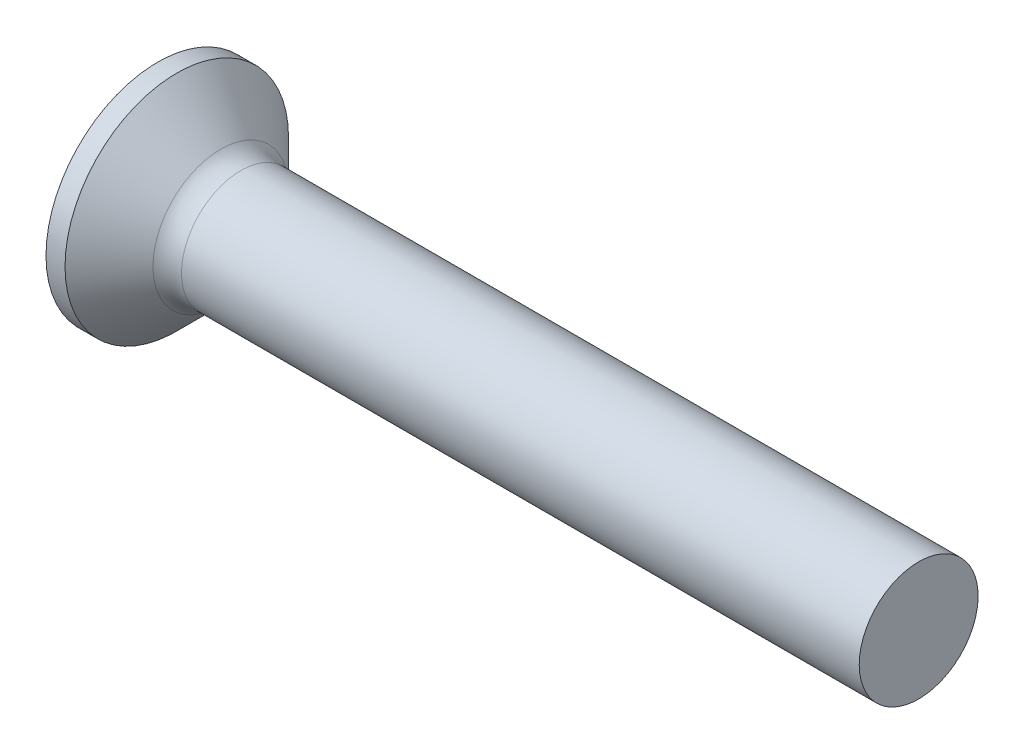
from build123d import *

# Parameters (mm, degrees)
FILLET1_R    = 0.6
RECPAT_COUNT = 2
RECPAT_ANGLE = 90


with BuildPart() as part:
    # BodySke → Base-Revolve (revolve)
    with BuildSketch(Plane.XY, mode=Mode.PRIVATE) as base_revolve_sk:
        Polygon((0, 0), (0, 2.35), (0.4, 2.35), (1.5, 1.25), (16, 1.25), (16, 0), align=None)
    revolve(base_revolve_sk.sketch.rotate(Axis((-6.35, 0, 0), (1, 0, 0)), 90), axis=Axis((-6.35, 0, 0), (1, 0, 0)))

    # Fillet1
    fillet1_edges = [part.edges().sort_by_distance(p)[0] for p in [
        (1.5, 0, -1.25),
    ]]
    fillet(fillet1_edges, radius=FILLET1_R)

    # Sketch3 → Recess section 0
    with BuildSketch(Plane.ZY):
        with BuildLine():
            Line((-0.37, 1.4), (0.37, 1.4))
            Line((0.37, 1.4), (0.37, -1.4))
            Line((0.37, -1.4), (-0.37, -1.4))
            Line((-0.37, -1.4), (-0.37, 1.4))
        make_face()
    # Sketch4 → Recess section 1
    with BuildSketch(Plane.ZY.offset(-1.73)):
        with BuildLine():
            Line((-0.37, 0.537453962), (0.37, 0.537453962))
            Line((0.37, 0.537453962), (0.37, -0.537453962))
            Line((0.37, -0.537453962), (-0.37, -0.537453962))
            Line((-0.37, -0.537453962), (-0.37, 0.537453962))
        make_face()
    recess = loft(mode=Mode.SUBTRACT)

    # RecPat: Recess ×2 about axis
    recpat_axis = Axis((0, 0, 0), (1, 0, 0))
    for i in range(1, RECPAT_COUNT):
        add(recess.rotate(recpat_axis, i * RECPAT_ANGLE / (RECPAT_COUNT - 1)), mode=Mode.SUBTRACT)

    # RecCorSke → RecessCore (revolve, cut)
    with BuildSketch(Plane.XY, mode=Mode.PRIVATE) as recesscore_sk:
        Polygon((0, 0), (0, 0.676973385), (1.73, 0.556), (1.910655351, 0), align=None)
    revolve(recesscore_sk.sketch.rotate(Axis((-3.175, 0, 0), (1, 0, 0)), 90), axis=Axis((-3.175, 0, 0), (1, 0, 0)), mode=Mode.SUBTRACT)


solid = part.part
